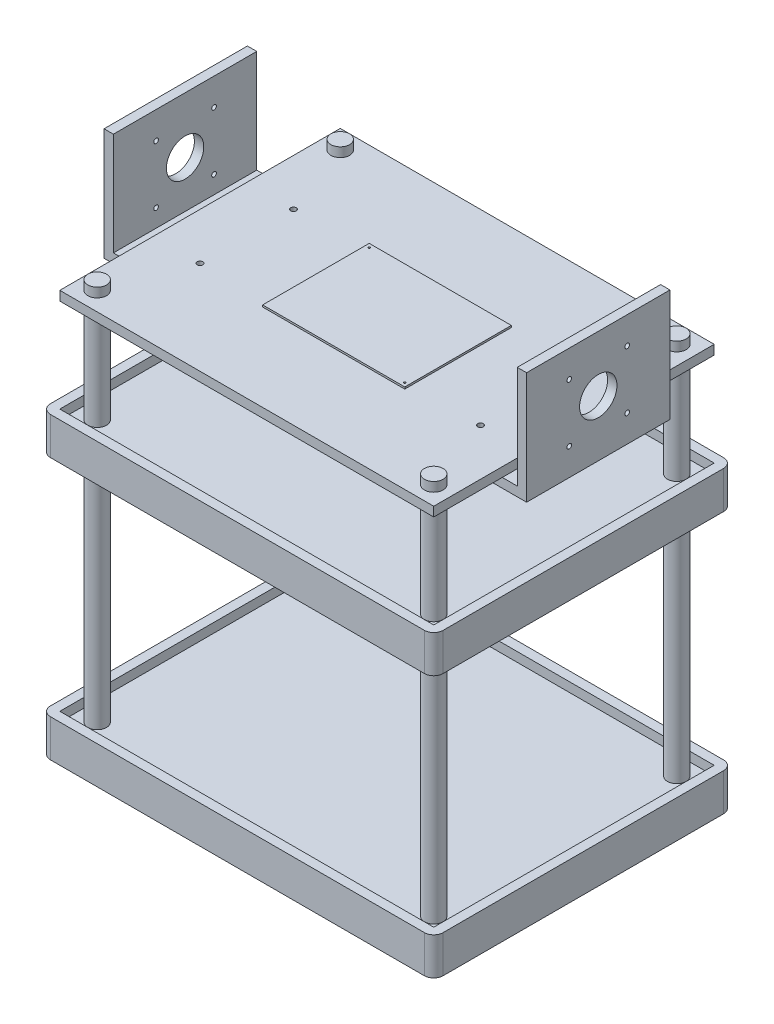
from build123d import *

# Parameters (mm, degrees)
SKETCH1_W            = 200
SKETCH1_H            = 150
BOSS_EXTRUDE1_DEPTH  = 5
SKETCH2_R            = 5
CUT_EXTRUDE1_DEPTH   = 10
SKETCH3_W            = 200
SKETCH3_H            = 150
SKETCH3_R            = 5
BOSS_EXTRUDE2_DEPTH  = 5
SKETCH4_W            = 200
SKETCH4_H            = 150
SKETCH4_R            = 5
BOSS_EXTRUDE3_DEPTH  = 5
BOSS_EXTRUDE13_START = 205
SKETCH21_R           = 5
BOSS_EXTRUDE13_DEPTH = 205
SKETCH22_R           = 5
BOSS_EXTRUDE14_DEPTH = 15
SKETCH23_R           = 1.5
CUT_EXTRUDE2_DEPTH   = 10
SKETCH27_W           = 76
SKETCH27_H           = 57
BOSS_EXTRUDE16_DEPTH = 1
SKETCH30_R           = 0.5
CUT_EXTRUDE3_DEPTH   = 30
SKETCH35_W           = 210
SKETCH35_H           = 160
SKETCH35_W_2         = 200
SKETCH35_H_2         = 150
BOSS_EXTRUDE19_DEPTH = 10
FILLET4_R            = 5
SKETCH39_W           = 210
SKETCH39_H           = 160
SKETCH39_W_2         = 200
SKETCH39_H_2         = 150
BOSS_EXTRUDE20_DEPTH = 10
FILLET5_R            = 5
SKETCH42_W           = 15
SKETCH42_H           = 20
SKETCH42_W_2         = 25
SKETCH42_H_2         = 50
SKETCH42_W_3         = 43.3
SKETCH42_H_3         = 43.3
BOSS_EXTRUDE23_DEPTH = 1
SKETCH46_W           = 30
SKETCH46_H           = 76.670556204
BOSS_EXTRUDE24_DEPTH = 5
SKETCH48_W           = 76.670556204
SKETCH48_H           = 60
SKETCH48_R           = 1.25
SKETCH48_R_2         = 10
BOSS_EXTRUDE25_DEPTH = 5
SKETCH54_W           = 76.670556204
SKETCH54_H           = 60
BOSS_EXTRUDE26_DEPTH = 5
SKETCH55_R           = 1.25
SKETCH55_R_2         = 10
CUT_EXTRUDE4_DEPTH   = 10


with BuildPart() as part:
    # Sketch1 → Boss-Extrude1 (new body)
    with BuildSketch(Plane(origin=(0, 0, 0), x_dir=(1, 0, 0), z_dir=(0, 1, 0))):
        Rectangle(SKETCH1_W, SKETCH1_H)
    extrude(amount=BOSS_EXTRUDE1_DEPTH)

    # Sketch2 → Cut-Extrude1 (cut)
    with BuildSketch(Plane(origin=(0, 5, 0), x_dir=(1, 0, 0), z_dir=(0, 1, 0))):
        with Locations(Location((-90, 65, 0), (0, 0, 270))):
            Circle(SKETCH2_R)
        with Locations(Location((90, 65, 0), (0, 0, 270))):
            Circle(SKETCH2_R)
        with Locations(Location((90, -65, 0), (0, 0, 270))):
            Circle(SKETCH2_R)
        with Locations(Location((-90, -65, 0), (0, 0, 270))):
            Circle(SKETCH2_R)
    extrude(amount=-CUT_EXTRUDE1_DEPTH, mode=Mode.SUBTRACT)



with BuildPart() as body_2:
    # Sketch3 → Boss-Extrude2 (new body)
    with BuildSketch(Plane(origin=(0, 140, 0), x_dir=(1, 0, 0), z_dir=(0, 1, 0))):
        Rectangle(SKETCH3_W, SKETCH3_H)
        with Locations(Location((-90, 65, 0), (0, 0, 270))):
            Circle(SKETCH3_R, mode=Mode.SUBTRACT)
        with Locations(Location((90, 65, 0), (0, 0, 270))):
            Circle(SKETCH3_R, mode=Mode.SUBTRACT)
        with Locations(Location((-90, -65, 0), (0, 0, 270))):
            Circle(SKETCH3_R, mode=Mode.SUBTRACT)
        with Locations(Location((90, -65, 0), (0, 0, 270))):
            Circle(SKETCH3_R, mode=Mode.SUBTRACT)
    extrude(amount=BOSS_EXTRUDE2_DEPTH)



with BuildPart() as body_3:
    # Sketch4 → Boss-Extrude3 (new body)
    with BuildSketch(Plane(origin=(0, 200, 0), x_dir=(1, 0, 0), z_dir=(0, 1, 0))):
        Rectangle(SKETCH4_W, SKETCH4_H)
        with Locations(Location((-90, 65, 0), (0, 0, 270))):
            Circle(SKETCH4_R, mode=Mode.SUBTRACT)
        with Locations(Location((90, 65, 0), (0, 0, 270))):
            Circle(SKETCH4_R, mode=Mode.SUBTRACT)
        with Locations(Location((90, -65, 0), (0, 0, 270))):
            Circle(SKETCH4_R, mode=Mode.SUBTRACT)
        with Locations(Location((-90, -65, 0), (0, 0, 270))):
            Circle(SKETCH4_R, mode=Mode.SUBTRACT)
    extrude(amount=BOSS_EXTRUDE3_DEPTH)


with BuildPart() as body_2_1:
    add(body_2.part)

    add(body_3.part)  # Boss-Extrude13 merges body 3
    # Sketch21 → Boss-Extrude13 (add)
    with BuildSketch(Plane(origin=(0, 5, 0), x_dir=(1, 0, 0), z_dir=(0, 1, 0)).offset(BOSS_EXTRUDE13_START)):
        with Locations(Location((-90, -65, 0), (0, 0, 270))):
            Circle(SKETCH21_R)
        with Locations(Location((-90, 65, 0), (0, 0, 270))):
            Circle(SKETCH21_R)
        with Locations(Location((90, 65, 0), (0, 0, 270))):
            Circle(SKETCH21_R)
        with Locations(Location((90, -65, 0), (0, 0, 270))):
            Circle(SKETCH21_R)
    extrude(amount=-BOSS_EXTRUDE13_DEPTH)


with BuildPart() as part_1:
    add(part.part)

    add(body_2_1.part)  # Boss-Extrude14 merges body 2
    # Sketch22 → Boss-Extrude14 (add)
    with BuildSketch(Plane(origin=(0, 5, 0), x_dir=(1, 0, 0), z_dir=(0, 1, 0))):
        with Locations(Location((-90, 65, 0), (0, 0, 270))):
            Circle(SKETCH22_R)
        with Locations(Location((-90, -65, 0), (0, 0, 270))):
            Circle(SKETCH22_R)
        with Locations(Location((90, -65, 0), (0, 0, 270))):
            Circle(SKETCH22_R)
        with Locations(Location((90, 65, 0), (0, 0, 270))):
            Circle(SKETCH22_R)
    extrude(amount=-BOSS_EXTRUDE14_DEPTH)

    # Sketch23 → Cut-Extrude2 (cut)
    with BuildSketch(Plane(origin=(0, 205, 0), x_dir=(1, 0, 0), z_dir=(0, 1, 0))):
        with Locations(Location((-75, 25, 0), (0, 0, 270))):
            Circle(SKETCH23_R)
        with Locations(Location((-75, -25, 0), (0, 0, 270))):
            Circle(SKETCH23_R)
        with Locations(Location((75, -25, 0), (0, 0, 270))):
            Circle(SKETCH23_R)
        with Locations(Location((75, 25, 0), (0, 0, 270))):
            Circle(SKETCH23_R)
    extrude(amount=-CUT_EXTRUDE2_DEPTH, mode=Mode.SUBTRACT)

    # Sketch27 → Boss-Extrude16 (add)
    with BuildSketch(Plane(origin=(0, 205, 0), x_dir=(1, 0, 0), z_dir=(0, 1, 0))):
        Rectangle(SKETCH27_W, SKETCH27_H)
    extrude(amount=BOSS_EXTRUDE16_DEPTH)

    # Sketch30 → Cut-Extrude3 (cut)
    with BuildSketch(Plane(origin=(0, 206, 0), x_dir=(1, 0, 0), z_dir=(0, 1, 0))):
        with Locations(Location((-36, 26.5, 0), (0, 0, 270))):
            Circle(SKETCH30_R)
        with Locations(Location((36, -26.5, 0), (0, 0, 270))):
            Circle(SKETCH30_R)
    extrude(amount=-CUT_EXTRUDE3_DEPTH, mode=Mode.SUBTRACT)

    # Sketch42 → Boss-Extrude23 (add)
    with BuildSketch(Plane.XZ.offset(-200)):
        Rectangle(SKETCH42_W, SKETCH42_H)
        with Locations((-58.240305189, 7.803312526)):
            Rectangle(SKETCH42_W_2, SKETCH42_H_2)
        with Locations((37.35, 2.211754737)):
            Rectangle(SKETCH42_W_3, SKETCH42_H_3)
    extrude(amount=BOSS_EXTRUDE23_DEPTH)

    # Sketch46 → Boss-Extrude24 (add)
    with BuildSketch(Plane(origin=(0, 200, 0), x_dir=(-1, 0, 0), z_dir=(0, -1, 0))):
        with Locations((-93, 0)):
            Rectangle(SKETCH46_W, SKETCH46_H)
        with Locations((93, 0)):
            Rectangle(SKETCH46_W, SKETCH46_H)
    extrude(amount=BOSS_EXTRUDE24_DEPTH)

    # Sketch48 → Boss-Extrude25 (add)
    with BuildSketch(Plane.ZY.offset(108)):
        with Locations((0, 225)):
            Rectangle(SKETCH48_W, SKETCH48_H)
        with Locations((-15.5, 209.5)):
            Circle(SKETCH48_R, mode=Mode.SUBTRACT)
        with Locations((15.5, 209.5)):
            Circle(SKETCH48_R, mode=Mode.SUBTRACT)
        with Locations(Location((15.5, 240.5, 0), (0, 0, 180))):
            Circle(SKETCH48_R, mode=Mode.SUBTRACT)
        with Locations(Location((-15.5, 240.5, 0), (0, 0, 180))):
            Circle(SKETCH48_R, mode=Mode.SUBTRACT)
        with Locations((0, 225)):
            Circle(SKETCH48_R_2, mode=Mode.SUBTRACT)
    extrude(amount=BOSS_EXTRUDE25_DEPTH)

    # Sketch54 → Boss-Extrude26 (add)
    with BuildSketch(Plane(origin=(108, 0, 0), x_dir=(0, 0, -1), z_dir=(1, 0, 0))):
        with Locations((0, 225)):
            Rectangle(SKETCH54_W, SKETCH54_H)
    extrude(amount=BOSS_EXTRUDE26_DEPTH)

    # Sketch55 → Cut-Extrude4 (cut)
    with BuildSketch(Plane(origin=(113, 0, 0), x_dir=(0, 0, -1), z_dir=(1, 0, 0))):
        with Locations(Location((-15.5, 209.5, 0), (0, 0, 180))):
            Circle(SKETCH55_R)
        with Locations(Location((15.5, 209.5, 0), (0, 0, 180))):
            Circle(SKETCH55_R)
        with Locations((15.5, 240.5)):
            Circle(SKETCH55_R)
        with Locations((-15.5, 240.5)):
            Circle(SKETCH55_R)
        with Locations(Location((0, 225, 0), (0, 0, 180))):
            Circle(SKETCH55_R_2)
    extrude(amount=-CUT_EXTRUDE4_DEPTH, mode=Mode.SUBTRACT)


with BuildPart() as body_2_2:
    # Sketch35 → Boss-Extrude19 (new, symmetric)
    with BuildSketch(Plane(origin=(0, 0, 0), x_dir=(-1, 0, 0), z_dir=(0, -1, 0))):
        Rectangle(SKETCH35_W, SKETCH35_H)
        Rectangle(SKETCH35_W_2, SKETCH35_H_2, mode=Mode.SUBTRACT)
    extrude(amount=BOSS_EXTRUDE19_DEPTH, both=True)

    # Fillet4
    fillet4_edges = [body_2_2.edges().sort_by_distance(p)[0] for p in [
        (105, 0, -80),
        (-105, 0, -80),
        (-105, 0, 80),
        (105, 0, 80),
    ]]
    fillet(fillet4_edges, radius=FILLET4_R)


with BuildPart() as body_3_2:
    # Sketch39 → Boss-Extrude20 (new, symmetric)
    with BuildSketch(Plane.XZ.offset(-140)):
        Rectangle(SKETCH39_W, SKETCH39_H)
        Rectangle(SKETCH39_W_2, SKETCH39_H_2, mode=Mode.SUBTRACT)
    extrude(amount=BOSS_EXTRUDE20_DEPTH, both=True)

    # Fillet5
    fillet5_edges = [body_3_2.edges().sort_by_distance(p)[0] for p in [
        (105, 140, -80),
        (-105, 140, -80),
        (-105, 140, 80),
        (105, 140, 80),
    ]]
    fillet(fillet5_edges, radius=FILLET5_R)


solid = Compound([part_1.part, body_2_2.part, body_3_2.part])
